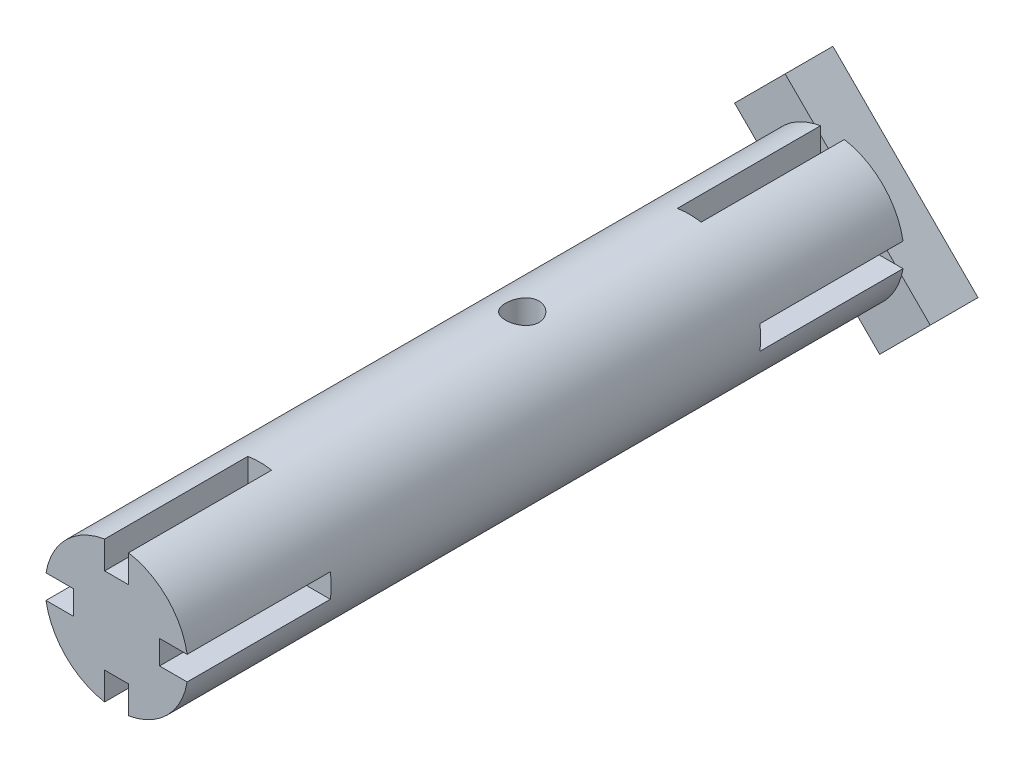
from build123d import *

# Parameters (mm, degrees)
SKETCH1_R                           = 1.5
BOSS_EXTRUDE1_DEPTH                 = 15
SKETCH2_W                           = 0.747320827
SKETCH2_H                           = 0.5
CUT_EXTRUDE1_DEPTH                  = 3
CIRPATTERN1_COUNT                   = 4
MIRROR1_COPY_1_SKETCH_W             = 0.747320827
MIRROR1_COPY_1_SKETCH_H             = 0.5
MIRROR1_COPY_1_DEPTH                = 3
MIRROR1_COPY_2_SKETCH_W             = 0.747320827
MIRROR1_COPY_2_SKETCH_H             = 0.5
MIRROR1_COPY_2_DEPTH                = 3
MIRROR1_COPY_3_SKETCH_W             = 0.747320827
MIRROR1_COPY_3_SKETCH_H             = 0.5
MIRROR1_COPY_3_DEPTH                = 3
BOSS_EXTRUDE5_DEPTH                 = 1
CUT_EXTRUDE2_REACH                  = 17.278
CUT_EXTRUDE2_END_RADIUS             = 1.5
SKETCH7_R                           = 0.35
CUT_EXTRUDE2_DIRECTION_2_REACH      = 17.278
CUT_EXTRUDE2_DIRECTION_2_END_RADIUS = 1.5


with BuildPart() as part:
    # Sketch1 → Boss-Extrude1 (new body)
    with BuildSketch(Plane.XY):
        Circle(SKETCH1_R)
    extrude(amount=BOSS_EXTRUDE1_DEPTH)

    # Sketch2 → Cut-Extrude1 (cut)
    with BuildSketch(Plane(origin=(0, 0, 0), x_dir=(-1, 0, 0), z_dir=(0, 0, -1))):
        with Locations((1.273660414, 0)):
            Rectangle(SKETCH2_W, SKETCH2_H)
    cut_extrude1 = extrude(amount=-CUT_EXTRUDE1_DEPTH, mode=Mode.SUBTRACT)

    # CirPattern1: Cut-Extrude1 ×4 about axis
    cirpattern1_axis = Axis((0, 0, 0), (0, 0, 1))
    for i in range(1, CIRPATTERN1_COUNT):
        add(cut_extrude1.rotate(cirpattern1_axis, i * 360 / CIRPATTERN1_COUNT), mode=Mode.SUBTRACT)

    # Mirror1: Cut-Extrude1 across plane
    add(cut_extrude1.mirror(Plane(origin=(0, 0, 7.5), x_dir=(1, 0, 0), z_dir=(0, 0, -1))), mode=Mode.SUBTRACT)

    # Mirror1 copy 1 sketch → Mirror1 copy 1 (cut)
    with BuildSketch(Plane(origin=(0, 0, 15), x_dir=(0, -1, 0), z_dir=(0, 0, 1))):
        with Locations((1.273660414, 0)):
            Rectangle(MIRROR1_COPY_1_SKETCH_W, MIRROR1_COPY_1_SKETCH_H)
    extrude(amount=-MIRROR1_COPY_1_DEPTH, mode=Mode.SUBTRACT)

    # Mirror1 copy 2 sketch → Mirror1 copy 2 (cut)
    with BuildSketch(Plane.XY.offset(15)):
        with Locations((1.273660414, 0)):
            Rectangle(MIRROR1_COPY_2_SKETCH_W, MIRROR1_COPY_2_SKETCH_H)
    extrude(amount=-MIRROR1_COPY_2_DEPTH, mode=Mode.SUBTRACT)

    # Mirror1 copy 3 sketch → Mirror1 copy 3 (cut)
    with BuildSketch(Plane(origin=(0, 0, 15), x_dir=(0, 1, 0), z_dir=(0, 0, 1))):
        with Locations((1.273660414, 0)):
            Rectangle(MIRROR1_COPY_3_SKETCH_W, MIRROR1_COPY_3_SKETCH_H)
    extrude(amount=-MIRROR1_COPY_3_DEPTH, mode=Mode.SUBTRACT)

    # Sketch6 → Boss-Extrude5 (add)
    with BuildSketch(Plane(origin=(0, 0, 0), x_dir=(-1, 0, 0), z_dir=(0, 0, -1))):
        Polygon((-0.989949494, -2.050609665), (-2.050609665, -0.989949494), (0.989949494, 2.050609665), (2.050609665, 0.989949494), align=None)
    extrude(amount=BOSS_EXTRUDE5_DEPTH)

    # Cut-Extrude2: up to this cylinder (the profile starts inside it)
    cut_extrude2_end = Plane(origin=(0, 0, 6.5), z_dir=(0, 0, -1)) * Cylinder(CUT_EXTRUDE2_END_RADIUS, 38.556, mode=Mode.PRIVATE)
    # Sketch7 → Cut-Extrude2 (cut, up to the surface)
    with BuildSketch(Plane(origin=(0, 0, 0), x_dir=(1, 0, 0), z_dir=(0, 1, 0)), mode=Mode.PRIVATE) as cut_extrude2_sk1:
        with Locations(Location((0, -6.5, 0), (0, 0, 270))):
            Circle(SKETCH7_R)
    cut_extrude2_tool1 = extrude(cut_extrude2_sk1.sketch, amount=-CUT_EXTRUDE2_REACH, mode=Mode.PRIVATE) & cut_extrude2_end
    add(cut_extrude2_tool1.solids().sort_by_distance((0, 0, 6.5))[0], mode=Mode.SUBTRACT)

    # Cut-Extrude2 direction 2: up to this cylinder (the profile starts inside it)
    cut_extrude2_direction_2_end = Plane(origin=(0, 0, 6.5), z_dir=(0, 0, -1)) * Cylinder(CUT_EXTRUDE2_DIRECTION_2_END_RADIUS, 38.556, mode=Mode.PRIVATE)
    # Sketch7 → Cut-Extrude2 direction 2 (cut, up to the surface)
    with BuildSketch(Plane(origin=(0, 0, 0), x_dir=(1, 0, 0), z_dir=(0, 1, 0)), mode=Mode.PRIVATE) as cut_extrude2_direction_2_sk1:
        with Locations(Location((0, -6.5, 0), (0, 0, 270))):
            Circle(SKETCH7_R)
    cut_extrude2_direction_2_tool1 = extrude(cut_extrude2_direction_2_sk1.sketch, amount=CUT_EXTRUDE2_DIRECTION_2_REACH, mode=Mode.PRIVATE) & cut_extrude2_direction_2_end
    add(cut_extrude2_direction_2_tool1.solids().sort_by_distance((0, 0, 6.5))[0], mode=Mode.SUBTRACT)


solid = part.part
